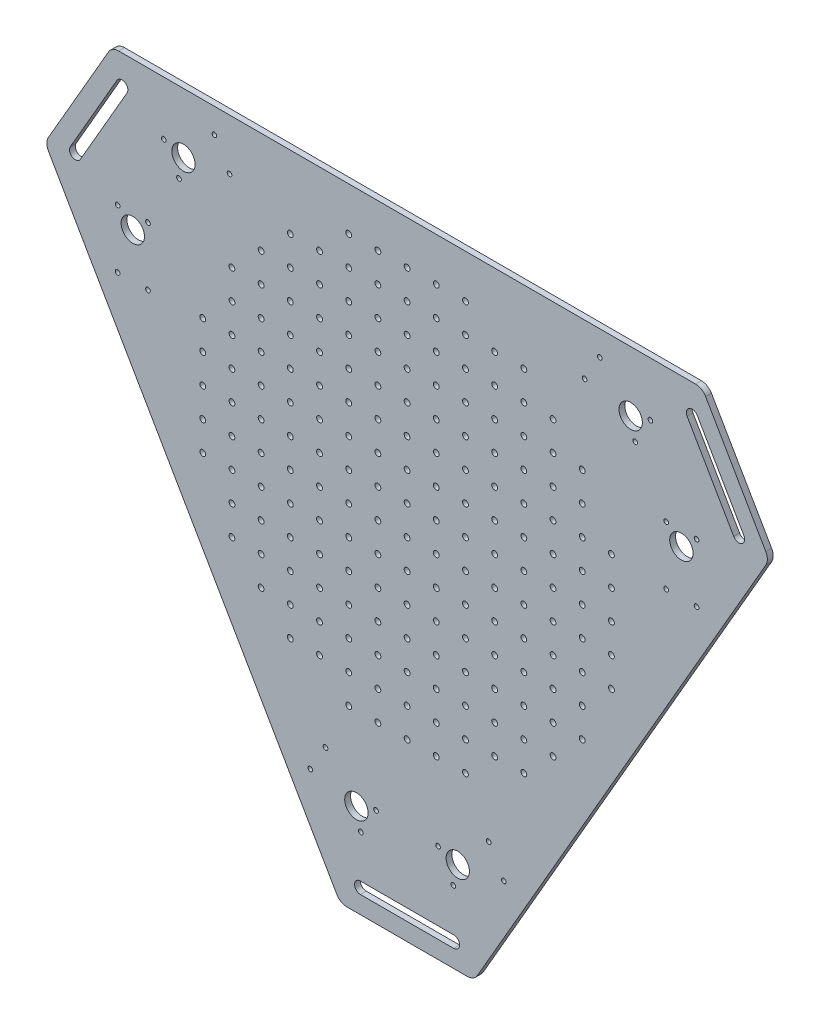
from build123d import *

# Parameters (mm, degrees)
SCHIZZO1_R                   = 2.5
SCHIZZO1_R_2                 = 2
SCHIZZO1_R_3                 = 10
ESTRUSIONE_ESTRUSIONE1_DEPTH = 5


with BuildPart() as part:
    # Schizzo1 → Estrusione-Estrusione1 (new body)
    with BuildSketch(Plane(origin=(0, 0, 595), x_dir=(-1, 0, 0), z_dir=(0, 0, -1))):
        with BuildLine():
            Line((60.193020077, -320), (307.224639249, 107.871315483))
            ThreePointArc((307.224639249, 107.871315483), (308.564385211, 112.871315483), (307.224639249, 117.871315483))
            Line((307.224639249, 117.871315483), (255.691873211, 207.128684516))
            ThreePointArc((255.691873211, 207.128684516), (252.031619173, 210.788938554), (247.031619173, 212.128684516))
            Line((247.031619173, 212.128684516), (-247.031619173, 212.128684516))
            ThreePointArc((-247.031619173, 212.128684516), (-252.031619173, 210.788938554), (-255.691873211, 207.128684516))
            Line((-255.691873211, 207.128684516), (-307.224639249, 117.871315484))
            ThreePointArc((-307.224639249, 117.871315484), (-308.564385211, 112.871315484), (-307.224639249, 107.871315484))
            Line((-307.224639249, 107.871315484), (-60.193020076, -320))
            ThreePointArc((-60.193020076, -320), (-56.532766038, -323.660254038), (-51.532766038, -325))
            Line((-51.532766038, -325), (51.532766039, -325))
            ThreePointArc((51.532766039, -325), (56.532766039, -323.660254038), (60.193020077, -320))
        make_face()
        with Locations(Location((-50, -175, 0), (0, 0, 180))):
            Circle(SCHIZZO1_R, mode=Mode.SUBTRACT)
        with Locations(Location((-25, -175, 0), (0, 0, 180))):
            Circle(SCHIZZO1_R, mode=Mode.SUBTRACT)
        with Locations(Location((-100, -150, 0), (0, 0, 180))):
            Circle(SCHIZZO1_R, mode=Mode.SUBTRACT)
        with Locations(Location((-75, -150, 0), (0, 0, 180))):
            Circle(SCHIZZO1_R, mode=Mode.SUBTRACT)
        with Locations(Location((-50, -150, 0), (0, 0, 180))):
            Circle(SCHIZZO1_R, mode=Mode.SUBTRACT)
        with Locations(Location((-25, -150, 0), (0, 0, 180))):
            Circle(SCHIZZO1_R, mode=Mode.SUBTRACT)
        with Locations(Location((-125, -125, 0), (0, 0, 180))):
            Circle(SCHIZZO1_R, mode=Mode.SUBTRACT)
        with Locations(Location((-100, -125, 0), (0, 0, 180))):
            Circle(SCHIZZO1_R, mode=Mode.SUBTRACT)
        with Locations(Location((-75, -125, 0), (0, 0, 180))):
            Circle(SCHIZZO1_R, mode=Mode.SUBTRACT)
        with Locations(Location((-50, -125, 0), (0, 0, 180))):
            Circle(SCHIZZO1_R, mode=Mode.SUBTRACT)
        with Locations(Location((-25, -125, 0), (0, 0, 180))):
            Circle(SCHIZZO1_R, mode=Mode.SUBTRACT)
        with Locations(Location((-150, -100, 0), (0, 0, 180))):
            Circle(SCHIZZO1_R, mode=Mode.SUBTRACT)
        with Locations(Location((-125, -100, 0), (0, 0, 180))):
            Circle(SCHIZZO1_R, mode=Mode.SUBTRACT)
        with Locations(Location((-100, -100, 0), (0, 0, 180))):
            Circle(SCHIZZO1_R, mode=Mode.SUBTRACT)
        with Locations(Location((-75, -100, 0), (0, 0, 180))):
            Circle(SCHIZZO1_R, mode=Mode.SUBTRACT)
        with Locations(Location((-50, -100, 0), (0, 0, 180))):
            Circle(SCHIZZO1_R, mode=Mode.SUBTRACT)
        with Locations(Location((-25, -100, 0), (0, 0, 180))):
            Circle(SCHIZZO1_R, mode=Mode.SUBTRACT)
        with Locations(Location((-150, -75, 0), (0, 0, 180))):
            Circle(SCHIZZO1_R, mode=Mode.SUBTRACT)
        with Locations(Location((-125, -75, 0), (0, 0, 180))):
            Circle(SCHIZZO1_R, mode=Mode.SUBTRACT)
        with Locations(Location((-100, -75, 0), (0, 0, 180))):
            Circle(SCHIZZO1_R, mode=Mode.SUBTRACT)
        with Locations(Location((-75, -75, 0), (0, 0, 180))):
            Circle(SCHIZZO1_R, mode=Mode.SUBTRACT)
        with Locations(Location((-50, -75, 0), (0, 0, 180))):
            Circle(SCHIZZO1_R, mode=Mode.SUBTRACT)
        with Locations(Location((-25, -75, 0), (0, 0, 180))):
            Circle(SCHIZZO1_R, mode=Mode.SUBTRACT)
        with Locations(Location((-175, -50, 0), (0, 0, 180))):
            Circle(SCHIZZO1_R, mode=Mode.SUBTRACT)
        with Locations(Location((-150, -50, 0), (0, 0, 180))):
            Circle(SCHIZZO1_R, mode=Mode.SUBTRACT)
        with Locations(Location((-125, -50, 0), (0, 0, 180))):
            Circle(SCHIZZO1_R, mode=Mode.SUBTRACT)
        with Locations(Location((-100, -50, 0), (0, 0, 180))):
            Circle(SCHIZZO1_R, mode=Mode.SUBTRACT)
        with Locations(Location((-75, -50, 0), (0, 0, 180))):
            Circle(SCHIZZO1_R, mode=Mode.SUBTRACT)
        with Locations(Location((-50, -50, 0), (0, 0, 180))):
            Circle(SCHIZZO1_R, mode=Mode.SUBTRACT)
        with Locations(Location((-25, -50, 0), (0, 0, 180))):
            Circle(SCHIZZO1_R, mode=Mode.SUBTRACT)
        with Locations(Location((-175, -25, 0), (0, 0, 180))):
            Circle(SCHIZZO1_R, mode=Mode.SUBTRACT)
        with Locations(Location((-150, -25, 0), (0, 0, 180))):
            Circle(SCHIZZO1_R, mode=Mode.SUBTRACT)
        with Locations(Location((-125, -25, 0), (0, 0, 180))):
            Circle(SCHIZZO1_R, mode=Mode.SUBTRACT)
        with Locations(Location((-100, -25, 0), (0, 0, 180))):
            Circle(SCHIZZO1_R, mode=Mode.SUBTRACT)
        with Locations(Location((-75, -25, 0), (0, 0, 180))):
            Circle(SCHIZZO1_R, mode=Mode.SUBTRACT)
        with Locations(Location((-50, -25, 0), (0, 0, 180))):
            Circle(SCHIZZO1_R, mode=Mode.SUBTRACT)
        with Locations(Location((-25, -25, 0), (0, 0, 180))):
            Circle(SCHIZZO1_R, mode=Mode.SUBTRACT)
        with Locations(Location((175, -50, 0), (0, 0, 180))):
            Circle(SCHIZZO1_R, mode=Mode.SUBTRACT)
        with Locations(Location((175, -25, 0), (0, 0, 180))):
            Circle(SCHIZZO1_R, mode=Mode.SUBTRACT)
        with Locations(Location((150, -100, 0), (0, 0, 180))):
            Circle(SCHIZZO1_R, mode=Mode.SUBTRACT)
        with Locations(Location((150, -75, 0), (0, 0, 180))):
            Circle(SCHIZZO1_R, mode=Mode.SUBTRACT)
        with Locations(Location((150, -50, 0), (0, 0, 180))):
            Circle(SCHIZZO1_R, mode=Mode.SUBTRACT)
        with Locations(Location((150, -25, 0), (0, 0, 180))):
            Circle(SCHIZZO1_R, mode=Mode.SUBTRACT)
        with Locations(Location((125, -125, 0), (0, 0, 180))):
            Circle(SCHIZZO1_R, mode=Mode.SUBTRACT)
        with Locations(Location((125, -100, 0), (0, 0, 180))):
            Circle(SCHIZZO1_R, mode=Mode.SUBTRACT)
        with Locations(Location((125, -75, 0), (0, 0, 180))):
            Circle(SCHIZZO1_R, mode=Mode.SUBTRACT)
        with Locations(Location((125, -50, 0), (0, 0, 180))):
            Circle(SCHIZZO1_R, mode=Mode.SUBTRACT)
        with Locations(Location((125, -25, 0), (0, 0, 180))):
            Circle(SCHIZZO1_R, mode=Mode.SUBTRACT)
        with Locations(Location((100, -150, 0), (0, 0, 180))):
            Circle(SCHIZZO1_R, mode=Mode.SUBTRACT)
        with Locations(Location((100, -125, 0), (0, 0, 180))):
            Circle(SCHIZZO1_R, mode=Mode.SUBTRACT)
        with Locations(Location((100, -100, 0), (0, 0, 180))):
            Circle(SCHIZZO1_R, mode=Mode.SUBTRACT)
        with Locations(Location((100, -75, 0), (0, 0, 180))):
            Circle(SCHIZZO1_R, mode=Mode.SUBTRACT)
        with Locations(Location((100, -50, 0), (0, 0, 180))):
            Circle(SCHIZZO1_R, mode=Mode.SUBTRACT)
        with Locations(Location((100, -25, 0), (0, 0, 180))):
            Circle(SCHIZZO1_R, mode=Mode.SUBTRACT)
        with Locations(Location((75, -150, 0), (0, 0, 180))):
            Circle(SCHIZZO1_R, mode=Mode.SUBTRACT)
        with Locations(Location((75, -125, 0), (0, 0, 180))):
            Circle(SCHIZZO1_R, mode=Mode.SUBTRACT)
        with Locations(Location((75, -100, 0), (0, 0, 180))):
            Circle(SCHIZZO1_R, mode=Mode.SUBTRACT)
        with Locations(Location((75, -75, 0), (0, 0, 180))):
            Circle(SCHIZZO1_R, mode=Mode.SUBTRACT)
        with Locations(Location((75, -50, 0), (0, 0, 180))):
            Circle(SCHIZZO1_R, mode=Mode.SUBTRACT)
        with Locations(Location((75, -25, 0), (0, 0, 180))):
            Circle(SCHIZZO1_R, mode=Mode.SUBTRACT)
        with Locations(Location((50, -175, 0), (0, 0, 180))):
            Circle(SCHIZZO1_R, mode=Mode.SUBTRACT)
        with Locations(Location((50, -150, 0), (0, 0, 180))):
            Circle(SCHIZZO1_R, mode=Mode.SUBTRACT)
        with Locations(Location((50, -125, 0), (0, 0, 180))):
            Circle(SCHIZZO1_R, mode=Mode.SUBTRACT)
        with Locations(Location((50, -100, 0), (0, 0, 180))):
            Circle(SCHIZZO1_R, mode=Mode.SUBTRACT)
        with Locations(Location((50, -75, 0), (0, 0, 180))):
            Circle(SCHIZZO1_R, mode=Mode.SUBTRACT)
        with Locations(Location((50, -50, 0), (0, 0, 180))):
            Circle(SCHIZZO1_R, mode=Mode.SUBTRACT)
        with Locations(Location((50, -25, 0), (0, 0, 180))):
            Circle(SCHIZZO1_R, mode=Mode.SUBTRACT)
        with Locations(Location((25, -175, 0), (0, 0, 180))):
            Circle(SCHIZZO1_R, mode=Mode.SUBTRACT)
        with Locations(Location((25, -150, 0), (0, 0, 180))):
            Circle(SCHIZZO1_R, mode=Mode.SUBTRACT)
        with Locations(Location((25, -125, 0), (0, 0, 180))):
            Circle(SCHIZZO1_R, mode=Mode.SUBTRACT)
        with Locations(Location((25, -100, 0), (0, 0, 180))):
            Circle(SCHIZZO1_R, mode=Mode.SUBTRACT)
        with Locations(Location((25, -75, 0), (0, 0, 180))):
            Circle(SCHIZZO1_R, mode=Mode.SUBTRACT)
        with Locations(Location((25, -50, 0), (0, 0, 180))):
            Circle(SCHIZZO1_R, mode=Mode.SUBTRACT)
        with Locations(Location((25, -25, 0), (0, 0, 180))):
            Circle(SCHIZZO1_R, mode=Mode.SUBTRACT)
        with Locations(Location((0, -75, 0), (0, 0, 180))):
            Circle(SCHIZZO1_R, mode=Mode.SUBTRACT)
        with Locations(Location((0, -175, 0), (0, 0, 180))):
            Circle(SCHIZZO1_R, mode=Mode.SUBTRACT)
        with Locations(Location((0, -150, 0), (0, 0, 180))):
            Circle(SCHIZZO1_R, mode=Mode.SUBTRACT)
        with Locations(Location((0, -125, 0), (0, 0, 180))):
            Circle(SCHIZZO1_R, mode=Mode.SUBTRACT)
        with Locations(Location((0, -100, 0), (0, 0, 180))):
            Circle(SCHIZZO1_R, mode=Mode.SUBTRACT)
        with Locations(Location((0, -50, 0), (0, 0, 180))):
            Circle(SCHIZZO1_R, mode=Mode.SUBTRACT)
        with Locations(Location((0, -25, 0), (0, 0, 180))):
            Circle(SCHIZZO1_R, mode=Mode.SUBTRACT)
        with Locations(Location((50, 175, 0), (0, 0, 180))):
            Circle(SCHIZZO1_R, mode=Mode.SUBTRACT)
        with Locations(Location((25, 175, 0), (0, 0, 180))):
            Circle(SCHIZZO1_R, mode=Mode.SUBTRACT)
        with Locations(Location((100, 150, 0), (0, 0, 180))):
            Circle(SCHIZZO1_R, mode=Mode.SUBTRACT)
        with Locations(Location((75, 150, 0), (0, 0, 180))):
            Circle(SCHIZZO1_R, mode=Mode.SUBTRACT)
        with Locations(Location((50, 150, 0), (0, 0, 180))):
            Circle(SCHIZZO1_R, mode=Mode.SUBTRACT)
        with Locations(Location((25, 150, 0), (0, 0, 180))):
            Circle(SCHIZZO1_R, mode=Mode.SUBTRACT)
        with Locations(Location((125, 125, 0), (0, 0, 180))):
            Circle(SCHIZZO1_R, mode=Mode.SUBTRACT)
        with Locations(Location((100, 125, 0), (0, 0, 180))):
            Circle(SCHIZZO1_R, mode=Mode.SUBTRACT)
        with Locations(Location((75, 125, 0), (0, 0, 180))):
            Circle(SCHIZZO1_R, mode=Mode.SUBTRACT)
        with Locations(Location((50, 125, 0), (0, 0, 180))):
            Circle(SCHIZZO1_R, mode=Mode.SUBTRACT)
        with Locations(Location((25, 125, 0), (0, 0, 180))):
            Circle(SCHIZZO1_R, mode=Mode.SUBTRACT)
        with Locations(Location((150, 100, 0), (0, 0, 180))):
            Circle(SCHIZZO1_R, mode=Mode.SUBTRACT)
        with Locations(Location((125, 100, 0), (0, 0, 180))):
            Circle(SCHIZZO1_R, mode=Mode.SUBTRACT)
        with Locations(Location((100, 100, 0), (0, 0, 180))):
            Circle(SCHIZZO1_R, mode=Mode.SUBTRACT)
        with Locations(Location((75, 100, 0), (0, 0, 180))):
            Circle(SCHIZZO1_R, mode=Mode.SUBTRACT)
        with Locations(Location((50, 100, 0), (0, 0, 180))):
            Circle(SCHIZZO1_R, mode=Mode.SUBTRACT)
        with Locations(Location((25, 100, 0), (0, 0, 180))):
            Circle(SCHIZZO1_R, mode=Mode.SUBTRACT)
        with Locations(Location((150, 75, 0), (0, 0, 180))):
            Circle(SCHIZZO1_R, mode=Mode.SUBTRACT)
        with Locations(Location((125, 75, 0), (0, 0, 180))):
            Circle(SCHIZZO1_R, mode=Mode.SUBTRACT)
        with Locations(Location((100, 75, 0), (0, 0, 180))):
            Circle(SCHIZZO1_R, mode=Mode.SUBTRACT)
        with Locations(Location((75, 75, 0), (0, 0, 180))):
            Circle(SCHIZZO1_R, mode=Mode.SUBTRACT)
        with Locations(Location((50, 75, 0), (0, 0, 180))):
            Circle(SCHIZZO1_R, mode=Mode.SUBTRACT)
        with Locations(Location((25, 75, 0), (0, 0, 180))):
            Circle(SCHIZZO1_R, mode=Mode.SUBTRACT)
        with Locations(Location((175, 50, 0), (0, 0, 180))):
            Circle(SCHIZZO1_R, mode=Mode.SUBTRACT)
        with Locations(Location((150, 50, 0), (0, 0, 180))):
            Circle(SCHIZZO1_R, mode=Mode.SUBTRACT)
        with Locations(Location((125, 50, 0), (0, 0, 180))):
            Circle(SCHIZZO1_R, mode=Mode.SUBTRACT)
        with Locations(Location((100, 50, 0), (0, 0, 180))):
            Circle(SCHIZZO1_R, mode=Mode.SUBTRACT)
        with Locations(Location((75, 50, 0), (0, 0, 180))):
            Circle(SCHIZZO1_R, mode=Mode.SUBTRACT)
        with Locations(Location((50, 50, 0), (0, 0, 180))):
            Circle(SCHIZZO1_R, mode=Mode.SUBTRACT)
        with Locations(Location((25, 50, 0), (0, 0, 180))):
            Circle(SCHIZZO1_R, mode=Mode.SUBTRACT)
        with Locations(Location((175, 25, 0), (0, 0, 180))):
            Circle(SCHIZZO1_R, mode=Mode.SUBTRACT)
        with Locations(Location((150, 25, 0), (0, 0, 180))):
            Circle(SCHIZZO1_R, mode=Mode.SUBTRACT)
        with Locations(Location((125, 25, 0), (0, 0, 180))):
            Circle(SCHIZZO1_R, mode=Mode.SUBTRACT)
        with Locations(Location((100, 25, 0), (0, 0, 180))):
            Circle(SCHIZZO1_R, mode=Mode.SUBTRACT)
        with Locations(Location((75, 25, 0), (0, 0, 180))):
            Circle(SCHIZZO1_R, mode=Mode.SUBTRACT)
        with Locations(Location((50, 25, 0), (0, 0, 180))):
            Circle(SCHIZZO1_R, mode=Mode.SUBTRACT)
        with Locations(Location((25, 25, 0), (0, 0, 180))):
            Circle(SCHIZZO1_R, mode=Mode.SUBTRACT)
        with Locations(Location((75, 0, 0), (0, 0, 180))):
            Circle(SCHIZZO1_R, mode=Mode.SUBTRACT)
        with Locations(Location((175, 0, 0), (0, 0, 180))):
            Circle(SCHIZZO1_R, mode=Mode.SUBTRACT)
        with Locations(Location((150, 0, 0), (0, 0, 180))):
            Circle(SCHIZZO1_R, mode=Mode.SUBTRACT)
        with Locations(Location((125, 0, 0), (0, 0, 180))):
            Circle(SCHIZZO1_R, mode=Mode.SUBTRACT)
        with Locations(Location((100, 0, 0), (0, 0, 180))):
            Circle(SCHIZZO1_R, mode=Mode.SUBTRACT)
        with Locations(Location((50, 0, 0), (0, 0, 180))):
            Circle(SCHIZZO1_R, mode=Mode.SUBTRACT)
        with Locations(Location((25, 0, 0), (0, 0, 180))):
            Circle(SCHIZZO1_R, mode=Mode.SUBTRACT)
        with Locations(Location((-175, 50, 0), (0, 0, 180))):
            Circle(SCHIZZO1_R, mode=Mode.SUBTRACT)
        with Locations(Location((-175, 25, 0), (0, 0, 180))):
            Circle(SCHIZZO1_R, mode=Mode.SUBTRACT)
        with Locations(Location((-175, 0, 0), (0, 0, 180))):
            Circle(SCHIZZO1_R, mode=Mode.SUBTRACT)
        with Locations(Location((-150, 100, 0), (0, 0, 180))):
            Circle(SCHIZZO1_R, mode=Mode.SUBTRACT)
        with Locations(Location((-150, 75, 0), (0, 0, 180))):
            Circle(SCHIZZO1_R, mode=Mode.SUBTRACT)
        with Locations(Location((-150, 50, 0), (0, 0, 180))):
            Circle(SCHIZZO1_R, mode=Mode.SUBTRACT)
        with Locations(Location((-150, 25, 0), (0, 0, 180))):
            Circle(SCHIZZO1_R, mode=Mode.SUBTRACT)
        with Locations(Location((-150, 0, 0), (0, 0, 180))):
            Circle(SCHIZZO1_R, mode=Mode.SUBTRACT)
        with Locations(Location((-125, 125, 0), (0, 0, 180))):
            Circle(SCHIZZO1_R, mode=Mode.SUBTRACT)
        with Locations(Location((-125, 100, 0), (0, 0, 180))):
            Circle(SCHIZZO1_R, mode=Mode.SUBTRACT)
        with Locations(Location((-125, 75, 0), (0, 0, 180))):
            Circle(SCHIZZO1_R, mode=Mode.SUBTRACT)
        with Locations(Location((-125, 50, 0), (0, 0, 180))):
            Circle(SCHIZZO1_R, mode=Mode.SUBTRACT)
        with Locations(Location((-125, 25, 0), (0, 0, 180))):
            Circle(SCHIZZO1_R, mode=Mode.SUBTRACT)
        with Locations(Location((-125, 0, 0), (0, 0, 180))):
            Circle(SCHIZZO1_R, mode=Mode.SUBTRACT)
        with Locations(Location((-100, 150, 0), (0, 0, 180))):
            Circle(SCHIZZO1_R, mode=Mode.SUBTRACT)
        with Locations(Location((-100, 125, 0), (0, 0, 180))):
            Circle(SCHIZZO1_R, mode=Mode.SUBTRACT)
        with Locations(Location((-100, 100, 0), (0, 0, 180))):
            Circle(SCHIZZO1_R, mode=Mode.SUBTRACT)
        with Locations(Location((-100, 75, 0), (0, 0, 180))):
            Circle(SCHIZZO1_R, mode=Mode.SUBTRACT)
        with Locations(Location((-100, 50, 0), (0, 0, 180))):
            Circle(SCHIZZO1_R, mode=Mode.SUBTRACT)
        with Locations(Location((-100, 25, 0), (0, 0, 180))):
            Circle(SCHIZZO1_R, mode=Mode.SUBTRACT)
        with Locations(Location((-100, 0, 0), (0, 0, 180))):
            Circle(SCHIZZO1_R, mode=Mode.SUBTRACT)
        with Locations(Location((-75, 150, 0), (0, 0, 180))):
            Circle(SCHIZZO1_R, mode=Mode.SUBTRACT)
        with Locations(Location((-75, 125, 0), (0, 0, 180))):
            Circle(SCHIZZO1_R, mode=Mode.SUBTRACT)
        with Locations(Location((-75, 100, 0), (0, 0, 180))):
            Circle(SCHIZZO1_R, mode=Mode.SUBTRACT)
        with Locations(Location((-75, 75, 0), (0, 0, 180))):
            Circle(SCHIZZO1_R, mode=Mode.SUBTRACT)
        with Locations(Location((-75, 50, 0), (0, 0, 180))):
            Circle(SCHIZZO1_R, mode=Mode.SUBTRACT)
        with Locations(Location((-75, 25, 0), (0, 0, 180))):
            Circle(SCHIZZO1_R, mode=Mode.SUBTRACT)
        with Locations(Location((-75, 0, 0), (0, 0, 180))):
            Circle(SCHIZZO1_R, mode=Mode.SUBTRACT)
        with Locations(Location((-50, 175, 0), (0, 0, 180))):
            Circle(SCHIZZO1_R, mode=Mode.SUBTRACT)
        with Locations(Location((-50, 150, 0), (0, 0, 180))):
            Circle(SCHIZZO1_R, mode=Mode.SUBTRACT)
        with Locations(Location((-50, 125, 0), (0, 0, 180))):
            Circle(SCHIZZO1_R, mode=Mode.SUBTRACT)
        with Locations(Location((-50, 100, 0), (0, 0, 180))):
            Circle(SCHIZZO1_R, mode=Mode.SUBTRACT)
        with Locations(Location((-50, 75, 0), (0, 0, 180))):
            Circle(SCHIZZO1_R, mode=Mode.SUBTRACT)
        with Locations(Location((-50, 50, 0), (0, 0, 180))):
            Circle(SCHIZZO1_R, mode=Mode.SUBTRACT)
        with Locations(Location((-50, 25, 0), (0, 0, 180))):
            Circle(SCHIZZO1_R, mode=Mode.SUBTRACT)
        with Locations(Location((-50, 0, 0), (0, 0, 180))):
            Circle(SCHIZZO1_R, mode=Mode.SUBTRACT)
        with Locations(Location((-25, 175, 0), (0, 0, 180))):
            Circle(SCHIZZO1_R, mode=Mode.SUBTRACT)
        with Locations(Location((-25, 150, 0), (0, 0, 180))):
            Circle(SCHIZZO1_R, mode=Mode.SUBTRACT)
        with Locations(Location((-25, 125, 0), (0, 0, 180))):
            Circle(SCHIZZO1_R, mode=Mode.SUBTRACT)
        with Locations(Location((-25, 100, 0), (0, 0, 180))):
            Circle(SCHIZZO1_R, mode=Mode.SUBTRACT)
        with Locations(Location((-25, 75, 0), (0, 0, 180))):
            Circle(SCHIZZO1_R, mode=Mode.SUBTRACT)
        with Locations(Location((-25, 50, 0), (0, 0, 180))):
            Circle(SCHIZZO1_R, mode=Mode.SUBTRACT)
        with Locations(Location((-25, 25, 0), (0, 0, 180))):
            Circle(SCHIZZO1_R, mode=Mode.SUBTRACT)
        with Locations(Location((-25, 0, 0), (0, 0, 180))):
            Circle(SCHIZZO1_R, mode=Mode.SUBTRACT)
        with Locations(Location((0, 75, 0), (0, 0, 180))):
            Circle(SCHIZZO1_R, mode=Mode.SUBTRACT)
        with Locations(Location((0, 175, 0), (0, 0, 180))):
            Circle(SCHIZZO1_R, mode=Mode.SUBTRACT)
        with Locations(Location((0, 150, 0), (0, 0, 180))):
            Circle(SCHIZZO1_R, mode=Mode.SUBTRACT)
        with Locations(Location((0, 125, 0), (0, 0, 180))):
            Circle(SCHIZZO1_R, mode=Mode.SUBTRACT)
        with Locations(Location((0, 100, 0), (0, 0, 180))):
            Circle(SCHIZZO1_R, mode=Mode.SUBTRACT)
        with Locations(Location((0, 50, 0), (0, 0, 180))):
            Circle(SCHIZZO1_R, mode=Mode.SUBTRACT)
        with Locations(Location((0, 25, 0), (0, 0, 180))):
            Circle(SCHIZZO1_R, mode=Mode.SUBTRACT)
        with Locations(Location((0, 0, 0), (0, 0, 180))):
            Circle(SCHIZZO1_R, mode=Mode.SUBTRACT)
        with Locations(Location((-208.356579013, 165.982273802, 0), (0, 0, 180))):
            Circle(SCHIZZO1_R_2, mode=Mode.SUBTRACT)
        with Locations(Location((-195.356579013, 143.465613303, 0), (0, 0, 180))):
            Circle(SCHIZZO1_R_2, mode=Mode.SUBTRACT)
        with Locations(Location((-165.055293949, 190.982282389, 0), (0, 0, 180))):
            Circle(SCHIZZO1_R_2, mode=Mode.SUBTRACT)
        with Locations(Location((-152.055293949, 168.465621891, 0), (0, 0, 180))):
            Circle(SCHIZZO1_R_2, mode=Mode.SUBTRACT)
        with Locations(Location((69.867861247, -215.916558285, 0), (0, 0, 180))):
            Circle(SCHIZZO1_R_2, mode=Mode.SUBTRACT)
        with Locations(Location((82.867861247, -238.433218784, 0), (0, 0, 180))):
            Circle(SCHIZZO1_R_2, mode=Mode.SUBTRACT)
        with Locations(Location((26.566576184, -240.916566873, 0), (0, 0, 180))):
            Circle(SCHIZZO1_R_2, mode=Mode.SUBTRACT)
        with Locations(Location((39.566576184, -263.433227372, 0), (0, 0, 180))):
            Circle(SCHIZZO1_R_2, mode=Mode.SUBTRACT)
        with Locations(Location((-39.566576184, -263.433227372, 0), (0, 0, 180))):
            Circle(SCHIZZO1_R_2, mode=Mode.SUBTRACT)
        with Locations(Location((-26.566576184, -240.916566873, 0), (0, 0, 180))):
            Circle(SCHIZZO1_R_2, mode=Mode.SUBTRACT)
        with Locations(Location((-82.867861247, -238.433218784, 0), (0, 0, 180))):
            Circle(SCHIZZO1_R_2, mode=Mode.SUBTRACT)
        with Locations(Location((-69.867861247, -215.916558285, 0), (0, 0, 180))):
            Circle(SCHIZZO1_R_2, mode=Mode.SUBTRACT)
        with Locations(Location((152.055293949, 168.465621891, 0), (0, 0, 180))):
            Circle(SCHIZZO1_R_2, mode=Mode.SUBTRACT)
        with Locations(Location((165.055293949, 190.982282389, 0), (0, 0, 180))):
            Circle(SCHIZZO1_R_2, mode=Mode.SUBTRACT)
        with Locations(Location((195.356579013, 143.465613303, 0), (0, 0, 180))):
            Circle(SCHIZZO1_R_2, mode=Mode.SUBTRACT)
        with Locations(Location((208.356579013, 165.982273802, 0), (0, 0, 180))):
            Circle(SCHIZZO1_R_2, mode=Mode.SUBTRACT)
        with Locations(Location((247.923155196, 97.45095357, 0), (0, 0, 180))):
            Circle(SCHIZZO1_R_2, mode=Mode.SUBTRACT)
        with Locations(Location((221.923155196, 97.45095357, 0), (0, 0, 180))):
            Circle(SCHIZZO1_R_2, mode=Mode.SUBTRACT)
        with Locations(Location((247.923155196, 47.450936394, 0), (0, 0, 180))):
            Circle(SCHIZZO1_R_2, mode=Mode.SUBTRACT)
        with Locations(Location((221.923155196, 47.450936394, 0), (0, 0, 180))):
            Circle(SCHIZZO1_R_2, mode=Mode.SUBTRACT)
        with Locations(Location((-221.923155196, 47.450936394, 0), (0, 0, 180))):
            Circle(SCHIZZO1_R_2, mode=Mode.SUBTRACT)
        with Locations(Location((-247.923155196, 47.450936394, 0), (0, 0, 180))):
            Circle(SCHIZZO1_R_2, mode=Mode.SUBTRACT)
        with Locations(Location((-221.923155196, 97.45095357, 0), (0, 0, 180))):
            Circle(SCHIZZO1_R_2, mode=Mode.SUBTRACT)
        with Locations(Location((-247.923155196, 97.45095357, 0), (0, 0, 180))):
            Circle(SCHIZZO1_R_2, mode=Mode.SUBTRACT)
        with Locations(Location((-234.923155196, 85.505035831, 0), (0, 0, 180))):
            Circle(SCHIZZO1_R_3, mode=Mode.SUBTRACT)
        with Locations(Location((-191.51111078, 160.696902422, 0), (0, 0, 180))):
            Circle(SCHIZZO1_R_3, mode=Mode.SUBTRACT)
        with Locations(Location((191.51111078, 160.696902422, 0), (0, 0, 180))):
            Circle(SCHIZZO1_R_3, mode=Mode.SUBTRACT)
        with Locations(Location((234.923155196, 85.505035831, 0), (0, 0, 180))):
            Circle(SCHIZZO1_R_3, mode=Mode.SUBTRACT)
        with Locations(Location((43.412044417, -246.201938253, 0), (0, 0, 180))):
            Circle(SCHIZZO1_R_3, mode=Mode.SUBTRACT)
        with Locations(Location((-43.412044417, -246.201938253, 0), (0, 0, 180))):
            Circle(SCHIZZO1_R_3, mode=Mode.SUBTRACT)
        with BuildLine():
            Line((39.985760655, -310), (-39.985760655, -310))
            ThreePointArc((-39.985760655, -310), (-44.985760655, -305), (-39.985760655, -300))
            Line((-39.985760655, -300), (39.985760655, -300))
            ThreePointArc((39.985760655, -300), (44.985760655, -305), (39.985760655, -310))
        make_face(mode=Mode.SUBTRACT)
        with BuildLine():
            Line((248.474994846, 189.628684516), (288.4607555, 120.371315484))
            ThreePointArc((288.4607555, 120.371315484), (286.630628481, 113.541188465), (279.800501462, 115.371315484))
            Line((279.800501462, 115.371315484), (239.814740808, 184.628684516))
            ThreePointArc((239.814740808, 184.628684516), (241.644867827, 191.458811535), (248.474994846, 189.628684516))
        make_face(mode=Mode.SUBTRACT)
        with BuildLine():
            Line((-239.814740809, 184.628684516), (-279.800501463, 115.371315484))
            ThreePointArc((-279.800501463, 115.371315484), (-286.630628481, 113.541188465), (-288.4607555, 120.371315484))
            Line((-288.4607555, 120.371315484), (-248.474994846, 189.628684516))
            ThreePointArc((-248.474994846, 189.628684516), (-241.644867828, 191.458811535), (-239.814740809, 184.628684516))
        make_face(mode=Mode.SUBTRACT)
    extrude(amount=-ESTRUSIONE_ESTRUSIONE1_DEPTH)


solid = part.part
